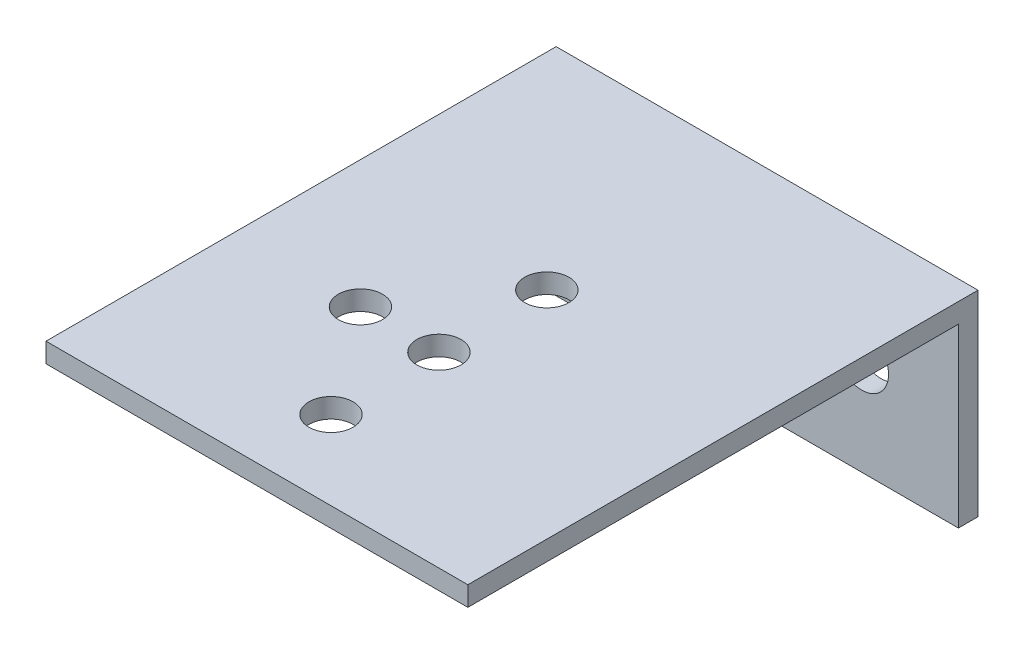
from build123d import *

# Parameters (mm, degrees)
ESQUISSE1_W             = 43
ESQUISSE1_H             = 20
BOSS_EXTRU_1_DEPTH      = 52
ESQUISSE2_W             = 57.277645312
ESQUISSE2_H             = 21.944309951
ENL_V_MAT_EXTRU_1_DEPTH = 50
D_GAGEMENT_M41_D        = 4.5
D_GAGEMENT_M51_D        = 5.5


with BuildPart() as part:
    # Esquisse1 → Boss.-Extru.1 (new body)
    with BuildSketch(Plane.XY):
        Rectangle(ESQUISSE1_W, ESQUISSE1_H)
    extrude(amount=BOSS_EXTRU_1_DEPTH)

    # Esquisse2 → Enlèv. mat.-Extru.1 (cut)
    with BuildSketch(Plane.XY.offset(52)):
        with Locations((1.570038745, -2.972154976)):
            Rectangle(ESQUISSE2_W, ESQUISSE2_H)
    extrude(amount=-ENL_V_MAT_EXTRU_1_DEPTH, mode=Mode.SUBTRACT)

    # Dégagement M41 (through all)
    with Locations(Plane(origin=(0, 10, 0), x_dir=(1, 0, 0), z_dir=(0, 1, 0))):
        with Locations((-0.5, -21.95), (-0.5, -32.95), (-0.5, -43.95), (-8.5, -32.95)):
            Hole(D_GAGEMENT_M41_D / 2)

    # Dégagement M51 (through all)
    with Locations(Plane(origin=(0, 0, 0), x_dir=(-1, 0, 0), z_dir=(0, 0, -1))):
        with Locations((-11.632687115, 0), (8.686603755, 0)):
            Hole(D_GAGEMENT_M51_D / 2)


solid = part.part
